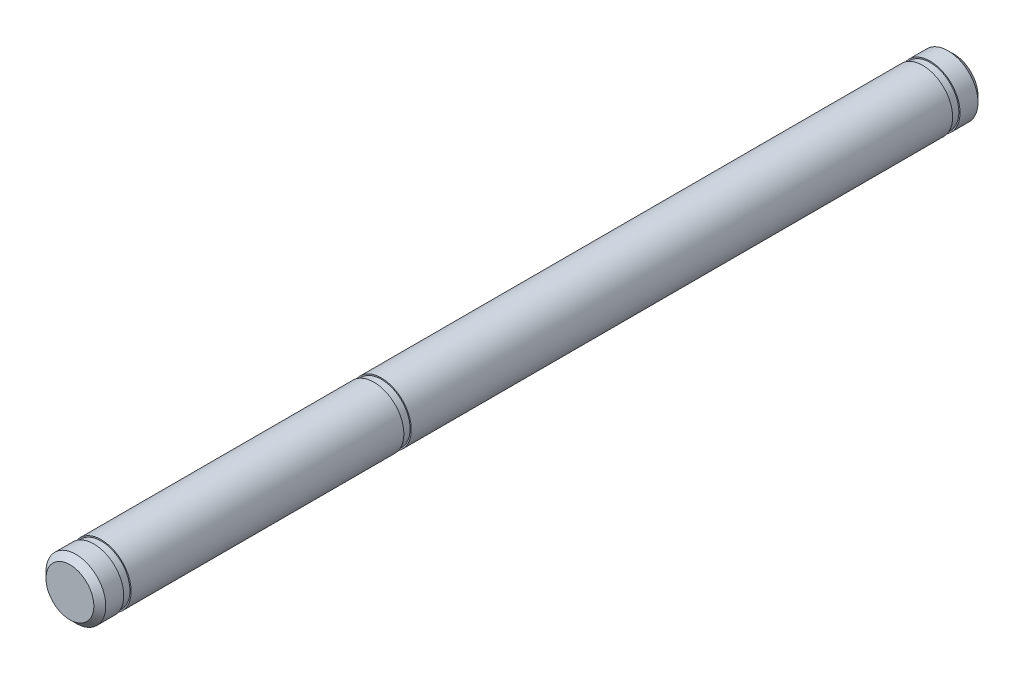
from build123d import *

# Parameters (mm, degrees)
BOSS_EXTRUDE1_DEPTH      = 50
BOSS_EXTRUDE1_DEPTH_BACK = 50
SKETCH3_R                = 2.5
CHAMFER1_SIZE            = 0.35
SKETCH5_W                = 1
SKETCH5_H                = 0.62
SKETCH5_W_2              = 2.5
SKETCH5_H_2              = 13.569648194
SKETCH5_H_3              = 12.496351806
CHAMFER3_SIZE            = 0.5


with BuildPart() as part:
    # Sketch3 → Boss-Extrude1 (new, two sides: drawn at the far end of the back side and taken through both)
    with BuildSketch(Plane.XY.offset(-BOSS_EXTRUDE1_DEPTH_BACK)):
        Circle(SKETCH3_R)
    extrude(amount=BOSS_EXTRUDE1_DEPTH + BOSS_EXTRUDE1_DEPTH_BACK)

    # Chamfer1
    chamfer1_edges = [part.edges().sort_by_distance(p)[0] for p in [
        (-2.5, 0, -50),
        (-2.5, 0, 50),
    ]]
    chamfer(chamfer1_edges, length=CHAMFER1_SIZE)

    # Sketch5 → Cut-Revolve5 (revolve, cut)
    with BuildSketch(Plane(origin=(0, 0, 0), x_dir=(1, 0, 0), z_dir=(0, 1, 0))):
        with Locations((2.9, 34.120351806)):
            Rectangle(SKETCH5_W, SKETCH5_H)
        with Locations((1.25, 43.215175903)):
            Rectangle(SKETCH5_W_2, SKETCH5_H_2)
        with Locations((2.9, -35.193648194)):
            Rectangle(SKETCH5_W, SKETCH5_H)
        with Locations((1.25, -43.751824097)):
            Rectangle(SKETCH5_W_2, SKETCH5_H_3)
        with Locations((2.9, -11.768648194)):
            Rectangle(SKETCH5_W, SKETCH5_H)
    revolve(axis=Axis((0, 0, 50), (0, 0, -1)), mode=Mode.SUBTRACT)

    # Chamfer3
    chamfer3_edges = [part.edges().sort_by_distance(p)[0] for p in [
        (-2.5, 0, 37.503648194),
        (-2.5, 0, -36.430351806),
    ]]
    chamfer(chamfer3_edges, length=CHAMFER3_SIZE)


solid = part.part
